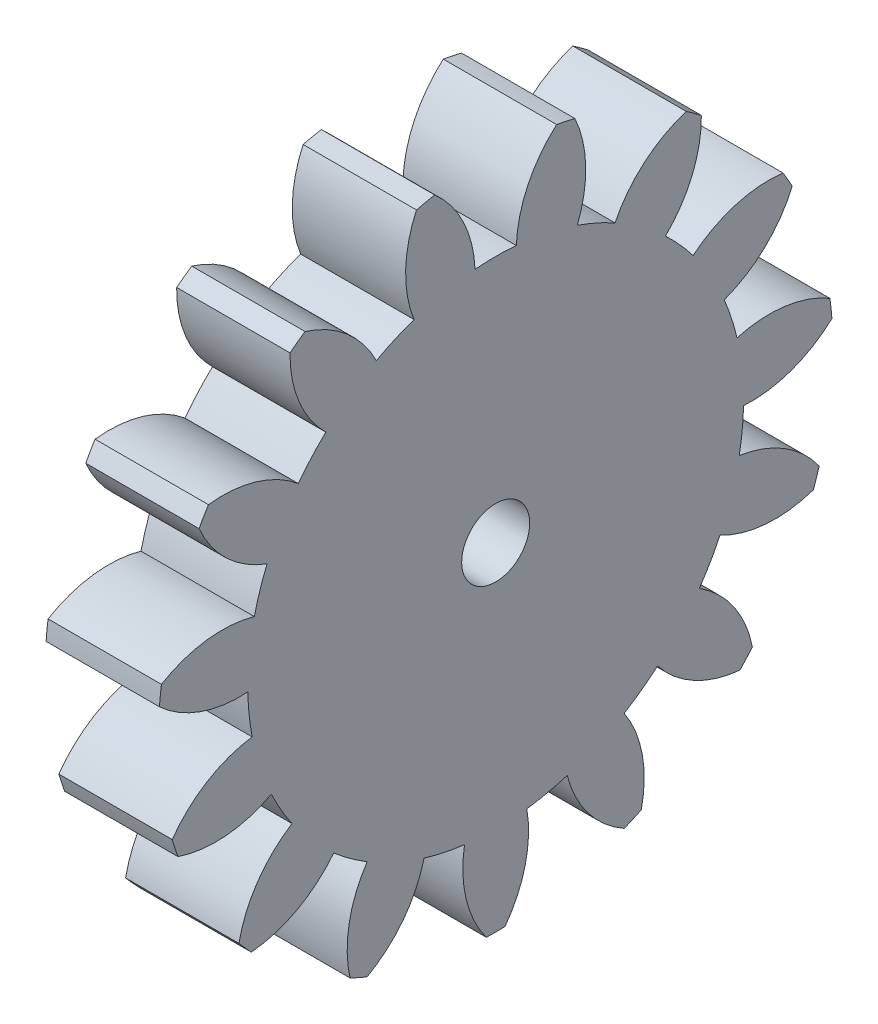
from build123d import *

# Parameters (mm, degrees)
BASPROSKE_W     = 5
BASPROSKE_H     = 14.875
TOOTHCUT_DEPTH  = 22.62247095
TEETHCUTS_COUNT = 15
TEETHCUTS_ANGLE = 336
BORSKE_R        = 1.5
BORE_DEPTH      = 50.0000508


with BuildPart() as part:
    # BasProSke → Base-Revolve (revolve)
    with BuildSketch(Plane(origin=(0, 0, 0), x_dir=(1, 0, 0), z_dir=(0, 1, 0)), mode=Mode.PRIVATE) as base_revolve_sk:
        with Locations((2.5, 7.4375)):
            Rectangle(BASPROSKE_W, BASPROSKE_H)
    revolve(base_revolve_sk.sketch.rotate(Axis((-10, 0, 0), (1, 0, 0)), 180), axis=Axis((-10, 0, 0), (1, 0, 0)))

    # TooCutSke → ToothCut (cut, through all)
    with BuildSketch(Plane(origin=(0, 0, 0), x_dir=(0, 0, -1), z_dir=(1, 0, 0))):
        with BuildLine():
            ThreePointArc((0.910581825, 10.898526184), (0, 10.9365), (-0.910581825, 10.898526184))
            ThreePointArc((-0.910581825, 10.898526184), (-1.424439469, 12.961252919), (-2.71409271, 14.651130363))
            ThreePointArc((-2.71409271, 14.651130363), (0, 14.9004), (2.71409271, 14.651130363))
            ThreePointArc((2.71409271, 14.651130363), (1.424439469, 12.961252919), (0.910581825, 10.898526184))
        make_face()
    toothcut = extrude(amount=TOOTHCUT_DEPTH, mode=Mode.SUBTRACT)

    # TeethCuts: ToothCut ×15 about axis
    teethcuts_axis = Axis((-10, 0, 0), (1, 0, 0))
    for i in range(1, TEETHCUTS_COUNT):
        add(toothcut.rotate(teethcuts_axis, i * TEETHCUTS_ANGLE / (TEETHCUTS_COUNT - 1)), mode=Mode.SUBTRACT)

    # BorSke → Bore (cut, symmetric)
    with BuildSketch(Plane(origin=(0, 0, 0), x_dir=(0, 0, -1), z_dir=(1, 0, 0))):
        with Locations(Location((0, 0, 0), (0, 0, 180))):
            Circle(BORSKE_R)
    extrude(amount=BORE_DEPTH, both=True, mode=Mode.SUBTRACT)


solid = part.part
